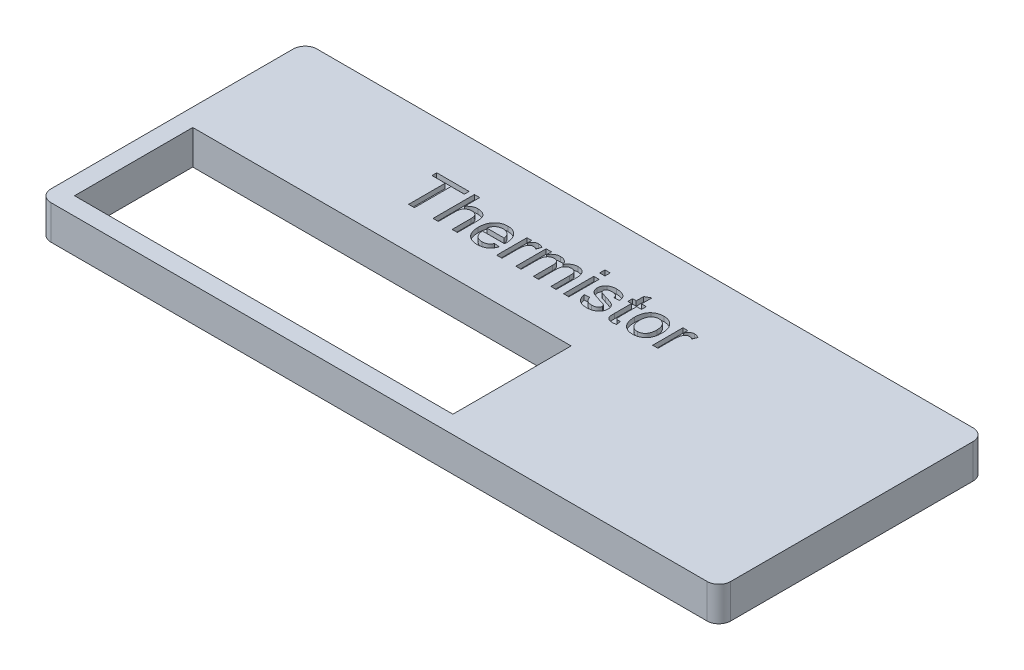
from build123d import *

# Parameters (mm, degrees)
BOSS_EXTRUDE1_DEPTH = 2.9
CUT_EXTRUDE1_DEPTH  = 10
SKETCH3_W           = 0.448717949
SKETCH3_H           = 0.448717949
SKETCH3_H_2         = 2.557692308
CUT_EXTRUDE2_DEPTH  = 0.5


with BuildPart() as part:
    # Sketch1 → Boss-Extrude1 (new body)
    with BuildSketch(Plane(origin=(0, 0, 0), x_dir=(1, 0, 0), z_dir=(0, 1, 0))):
        with BuildLine():
            Line((1, 0), (56.5, 0))
            ThreePointArc((56.5, 0), (57.207106781, 0.292893219), (57.5, 1))
            Line((57.5, 1), (57.5, 21.5))
            ThreePointArc((57.5, 21.5), (57.207106781, 22.207106781), (56.5, 22.5))
            Line((56.5, 22.5), (1, 22.5))
            ThreePointArc((1, 22.5), (0.292893219, 22.207106781), (0, 21.5))
            Line((0, 21.5), (0, 1))
            ThreePointArc((0, 1), (0.292893219, 0.292893219), (1, 0))
        make_face()
    extrude(amount=BOSS_EXTRUDE1_DEPTH)

    # Sketch2 → Cut-Extrude1 (cut)
    with BuildSketch(Plane(origin=(0, 0, 0), x_dir=(1, 0, 0), z_dir=(0, 1, 0))):
        Polygon((1.5, 11.5), (1.5, 1.5), (5.5, 1.5), (33.5, 1.5), (33.5, 11.5), align=None)
    extrude(amount=CUT_EXTRUDE1_DEPTH, mode=Mode.SUBTRACT)

    # Sketch3 → Cut-Extrude2 (cut)
    # profile 1 of 11: a face of its own
    with BuildSketch(Plane(origin=(0, 3, 0), x_dir=(1, 0, 0), z_dir=(0, 1, 0))):
        Polygon((16.256410256, 15), (16.256410256, 18.096153846), (15.134615385, 18.096153846), (15.134615385, 18.5), (17.871794872, 18.5), (17.871794872, 18.096153846), (16.75, 18.096153846), (16.75, 15), align=None)
    # profile 2 of 11: a face of its own
    with BuildSketch(Plane(origin=(0, 3, 0), x_dir=(1, 0, 0), z_dir=(0, 1, 0))):
        with BuildLine():
            Line((18.320512821, 15), (18.320512821, 18.5))
            Line((18.320512821, 18.5), (18.769230769, 18.5))
            Line((18.769230769, 18.5), (18.769230769, 17.221854968))
            add(Edge.make_bspline(
                [(18.769230769, 17.221854968), (18.794079358, 17.252104718), (18.842872975, 17.311504255), (18.925191786, 17.389105738), (19.01208256, 17.455536539), (19.104562491, 17.508587822), (19.201062428, 17.551701893), (19.303120274, 17.580546409), (19.409553396, 17.599897429), (19.482416778, 17.601665785), (19.51943109, 17.602564103)],
                knots=[0, 0, 0, 0, 1.075179344, 2.11126231, 3.101893549, 4.07484835, 5.035680757, 5.999322527, 6.983663715, 8, 8, 8, 8], degree=3))
            add(Edge.make_bspline(
                [(19.51943109, 17.602564103), (19.564400857, 17.601345725), (19.651592096, 17.598983429), (19.777649101, 17.577049907), (19.895224655, 17.543440682), (20.002317395, 17.494070877), (20.098174203, 17.433558586), (20.180266733, 17.36102193), (20.247692709, 17.277752437), (20.290621485, 17.198944304), (20.318715386, 17.130449723), (20.33570173, 17.072462625), (20.351164519, 17.009586014), (20.364023927, 16.941051585), (20.372473623, 16.86673756), (20.379680903, 16.787040969), (20.383870046, 16.701666968), (20.384361159, 16.642966499), (20.384615385, 16.612580128)],
                knots=[0, 0, 0, 0, 1.423572297, 2.760143949, 4.041704725, 5.287516156, 6.482931736, 7.621116371, 8.742804, 9.859691372, 10.450931907, 11.085684043, 11.77170108, 12.502189623, 13.292936877, 14.140280139, 15.037313705, 16, 16, 16, 16], degree=3))
            Line((20.384615385, 16.612580128), (20.384615385, 15))
            Line((20.384615385, 15), (19.935897436, 15))
            Line((19.935897436, 15), (19.935897436, 16.589443109))
            add(Edge.make_bspline(
                [(19.935897436, 16.589443109), (19.935523443, 16.615164741), (19.934801438, 16.664821106), (19.928459456, 16.736503635), (19.918067437, 16.802847253), (19.90347159, 16.863859103), (19.884875505, 16.919803781), (19.860762643, 16.969628019), (19.833321052, 17.014496609), (19.801590747, 17.05417471), (19.765625159, 17.088316771), (19.726723129, 17.118559604), (19.683628794, 17.142667261), (19.637515384, 17.16341918), (19.587699731, 17.179552), (19.53428213, 17.190331897), (19.477575948, 17.197846455), (19.438594975, 17.19842121), (19.418469551, 17.198717949)],
                knots=[0, 0, 0, 0, 1.348466509, 2.603254179, 3.769725567, 4.866462031, 5.889525116, 6.854190675, 7.762162134, 8.642507241, 9.509185433, 10.357210019, 11.219023099, 12.091228191, 13.005791182, 13.957527608, 14.945495211, 16, 16, 16, 16], degree=3))
            add(Edge.make_bspline(
                [(19.418469551, 17.198717949), (19.387993367, 17.197488932), (19.327657438, 17.195055757), (19.238439266, 17.175903636), (19.152145015, 17.145032261), (19.069859065, 17.102354661), (18.99424561, 17.049968727), (18.929634005, 16.986847028), (18.877138335, 16.914913375), (18.835218652, 16.833481498), (18.805573527, 16.73928831), (18.784280658, 16.630919877), (18.771118161, 16.506796524), (18.769882909, 16.418637908), (18.769230769, 16.372095353)],
                knots=[0, 0, 0, 0, 0.917620555, 1.816680451, 2.736567805, 3.671956967, 4.601896568, 5.4982222, 6.379906244, 7.274321234, 8.245216896, 9.344499276, 10.598052048, 12, 12, 12, 12], degree=3))
            Line((18.769230769, 16.372095353), (18.769230769, 15))
            Line((18.769230769, 15), (18.320512821, 15))
        make_face()
    # profile 3 of 11: a face of its own
    with BuildSketch(Plane(origin=(0, 3, 0), x_dir=(1, 0, 0), z_dir=(0, 1, 0))):
        with BuildLine():
            Line((22.75791266, 15.762820513), (23.197516026, 15.717948718))
            add(Edge.make_bspline(
                [(23.197516026, 15.717948718), (23.188502414, 15.688296348), (23.170770878, 15.629964337), (23.134793497, 15.547231904), (23.095259214, 15.468632168), (23.048550263, 15.395877903), (22.997299194, 15.32742068), (22.940490543, 15.26380654), (22.876882544, 15.206640566), (22.808839523, 15.153535451), (22.735229324, 15.106865004), (22.656827899, 15.065660563), (22.57334817, 15.031654596), (22.48502839, 15.003325724), (22.391666677, 14.981719425), (22.293436242, 14.966792807), (22.190466688, 14.956217868), (22.120153995, 14.955497322), (22.084134615, 14.955128205)],
                knots=[0, 0, 0, 0, 1.017198368, 2.001028156, 2.958938375, 3.904526299, 4.836491671, 5.766019286, 6.700699831, 7.641977538, 8.598163567, 9.559604839, 10.547559217, 11.555094156, 12.60347703, 13.691418688, 14.817373327, 16, 16, 16, 16], degree=3))
            add(Edge.make_bspline(
                [(22.084134615, 14.955128205), (22.038976972, 14.956189389), (21.950933573, 14.958258369), (21.822356911, 14.974856256), (21.700905667, 15.001112267), (21.586315347, 15.038312422), (21.47932029, 15.086791035), (21.37964879, 15.14641453), (21.286680882, 15.215805403), (21.201754831, 15.29618568), (21.124917135, 15.385770716), (21.059294601, 15.485381426), (21.002381299, 15.592630574), (20.957116063, 15.709260301), (20.921338143, 15.83410287), (20.896513928, 15.967689578), (20.8806314, 16.109490425), (20.879027872, 16.207053398), (20.878205128, 16.257111378)],
                knots=[0, 0, 0, 0, 1.077616366, 2.10101772, 3.089143248, 4.040031729, 4.971276009, 5.886882173, 6.807369977, 7.734796568, 8.672701003, 9.618074947, 10.576315496, 11.565652878, 12.598619221, 13.67195277, 14.805516698, 16, 16, 16, 16], degree=3))
            add(Edge.make_bspline(
                [(20.878205128, 16.257111378), (20.879035846, 16.309034007), (20.880648846, 16.409851923), (20.896327739, 16.556642617), (20.92225739, 16.69446477), (20.957443177, 16.82381841), (21.004066674, 16.94407866), (21.060955793, 17.055201677), (21.127758773, 17.157789114), (21.205120908, 17.250338761), (21.290722634, 17.332637973), (21.381844178, 17.405820119), (21.480397928, 17.466214914), (21.584369381, 17.516358836), (21.69476062, 17.554884434), (21.810891623, 17.583256642), (21.933646637, 17.599266301), (22.017482973, 17.601449293), (22.060296474, 17.602564103)],
                knots=[0, 0, 0, 0, 1.232307979, 2.392766439, 3.499416159, 4.558769794, 5.570548426, 6.555643267, 7.517416609, 8.470735273, 9.412423306, 10.33263532, 11.239503873, 12.150233765, 13.067967044, 14.009932887, 14.983713455, 16, 16, 16, 16], degree=3))
            add(Edge.make_bspline(
                [(22.060296474, 17.602564103), (22.101720164, 17.601498886), (22.182787532, 17.599414226), (22.301553965, 17.582682538), (22.414724016, 17.556536454), (22.522060084, 17.518560696), (22.623021955, 17.468711187), (22.718700023, 17.409214649), (22.808425914, 17.338349148), (22.891624175, 17.257080281), (22.967430175, 17.166320509), (23.033003503, 17.065717847), (23.088527798, 16.956686925), (23.13353855, 16.838394186), (23.168186173, 16.711521452), (23.193287454, 16.575985658), (23.209117511, 16.431832885), (23.210716485, 16.332641473), (23.211538462, 16.281650641)],
                knots=[0, 0, 0, 0, 1.005323219, 1.967446859, 2.906060863, 3.821317632, 4.724696067, 5.63467896, 6.55185077, 7.494776645, 8.453732942, 9.416859909, 10.403972786, 11.418730779, 12.484189468, 13.592581733, 14.76243057, 16, 16, 16, 16], degree=3))
            add(Edge.make_bspline(
                [(23.211538462, 16.281650641), (23.211324934, 16.265758188), (23.210809922, 16.22742689), (23.209942739, 16.189101849), (23.209435096, 16.166666667)],
                knots=[0, 0, 0, 0, 0.829215456, 2, 2, 2, 2], degree=3))
            Line((23.209435096, 16.166666667), (21.326923077, 16.166666667))
            add(Edge.make_bspline(
                [(21.326923077, 16.166666667), (21.329520811, 16.135065356), (21.334603018, 16.073240559), (21.349423476, 15.983729659), (21.369424041, 15.899607765), (21.396347161, 15.821615578), (21.428152329, 15.74887961), (21.467458164, 15.682596256), (21.511248206, 15.621293352), (21.561561875, 15.566465499), (21.615860082, 15.517696575), (21.673965676, 15.474915241), (21.735775615, 15.439431508), (21.800395715, 15.409601109), (21.868429839, 15.387153696), (21.939567502, 15.371089663), (22.01420573, 15.361039504), (22.065172494, 15.359671508), (22.091145833, 15.358974359)],
                knots=[0, 0, 0, 0, 1.224729154, 2.396059788, 3.502114335, 4.561587772, 5.580251543, 6.563724943, 7.533714888, 8.486186356, 9.43260269, 10.350144711, 11.268619442, 12.181885516, 13.095687177, 14.031096784, 14.996620783, 16, 16, 16, 16], degree=3))
            add(Edge.make_bspline(
                [(22.091145833, 15.358974359), (22.129068753, 15.36024408), (22.20253503, 15.362703851), (22.30854021, 15.379960912), (22.405710622, 15.410388575), (22.494729135, 15.452626154), (22.575448028, 15.508615494), (22.645882038, 15.580280814), (22.708503092, 15.665217081), (22.741073176, 15.729555873), (22.75791266, 15.762820513)],
                knots=[0, 0, 0, 0, 1.096312125, 2.123833578, 3.094060441, 4.030938787, 4.962563683, 5.918139224, 6.923629937, 8, 8, 8, 8], degree=3))
        make_face()
        with BuildLine():
            Line((21.326923077, 16.570512821), (22.762820513, 16.570512821))
            add(Edge.make_bspline(
                [(22.762820513, 16.570512821), (22.759995949, 16.592745256), (22.75447331, 16.636214531), (22.742849042, 16.699087406), (22.727345965, 16.757665577), (22.708674885, 16.811729025), (22.68590677, 16.861381249), (22.660182509, 16.906698434), (22.631438877, 16.94816454), (22.609099289, 16.972262917), (22.598056891, 16.984174679)],
                knots=[0, 0, 0, 0, 1.185316253, 2.317552585, 3.379013743, 4.387694847, 5.339152611, 6.263729899, 7.141766409, 8, 8, 8, 8], degree=3))
            add(Edge.make_bspline(
                [(22.598056891, 16.984174679), (22.580413657, 17.001395038), (22.545565253, 17.035408189), (22.487463531, 17.079253316), (22.42502134, 17.115613554), (22.35945263, 17.146985753), (22.289290807, 17.16971409), (22.21594061, 17.186884029), (22.138380988, 17.196610504), (22.085329094, 17.198004779), (22.058193109, 17.198717949)],
                knots=[0, 0, 0, 0, 0.989486767, 1.954405495, 2.91383024, 3.888017634, 4.867526279, 5.869356945, 6.910178459, 8, 8, 8, 8], degree=3))
            add(Edge.make_bspline(
                [(22.058193109, 17.198717949), (22.033633084, 17.198147613), (21.985558529, 17.197031219), (21.914734129, 17.189175169), (21.846853455, 17.176151853), (21.782036837, 17.156828994), (21.720047519, 17.133344349), (21.661321367, 17.103323722), (21.60544731, 17.068440798), (21.552647892, 17.028539475), (21.504883861, 16.983822693), (21.461203033, 16.936189371), (21.425039683, 16.883543626), (21.392975413, 16.828338405), (21.367868873, 16.768850828), (21.348103898, 16.70595722), (21.33403432, 16.639484249), (21.329314612, 16.593708148), (21.326923077, 16.570512821)],
                knots=[0, 0, 0, 0, 1.10270868, 2.158476208, 3.195774995, 4.201977093, 5.192014471, 6.168217026, 7.158254405, 8.146844603, 9.134487423, 10.093158795, 11.042305272, 11.996428104, 12.955501471, 13.934632866, 14.95345241, 16, 16, 16, 16], degree=3))
        make_face(mode=Mode.SUBTRACT)
    # profile 4 of 11: a face of its own
    with BuildSketch(Plane(origin=(0, 3, 0), x_dir=(1, 0, 0), z_dir=(0, 1, 0))):
        with BuildLine():
            Line((23.705128205, 15), (23.705128205, 17.557692308))
            Line((23.705128205, 17.557692308), (24.108974359, 17.557692308))
            Line((24.108974359, 17.557692308), (24.108974359, 17.200821314))
            add(Edge.make_bspline(
                [(24.108974359, 17.200821314), (24.131564075, 17.23856757), (24.173414557, 17.308497576), (24.239420526, 17.400647372), (24.302224472, 17.472819826), (24.365624054, 17.524245533), (24.429069698, 17.559836274), (24.493855096, 17.584338576), (24.561635891, 17.599903329), (24.607855181, 17.601668388), (24.631310096, 17.602564103)],
                knots=[0, 0, 0, 0, 1.517336028, 2.811068648, 3.907416798, 4.807929446, 5.613162482, 6.406966847, 7.191583018, 8, 8, 8, 8], degree=3))
            add(Edge.make_bspline(
                [(24.631310096, 17.602564103), (24.666024256, 17.601014866), (24.736385708, 17.597874748), (24.841810718, 17.573775693), (24.94848307, 17.537238187), (25.016425207, 17.50117436), (25.051282051, 17.482672276)],
                knots=[0, 0, 0, 0, 0.943117096, 1.911585642, 2.928565726, 4, 4, 4, 4], degree=3))
            Line((25.051282051, 17.482672276), (24.911057692, 17.093549679))
            add(Edge.make_bspline(
                [(24.911057692, 17.093549679), (24.886713199, 17.109735919), (24.839762366, 17.140952727), (24.764478904, 17.174014667), (24.689256051, 17.195116388), (24.6386861, 17.197529547), (24.613782051, 17.198717949)],
                knots=[0, 0, 0, 0, 1.093324321, 2.108587182, 3.068540977, 4, 4, 4, 4], degree=3))
            add(Edge.make_bspline(
                [(24.613782051, 17.198717949), (24.592179489, 17.197620504), (24.549526033, 17.195453639), (24.487204024, 17.17862316), (24.428569887, 17.150806896), (24.373668823, 17.112861014), (24.324840119, 17.064897149), (24.28198396, 17.008802769), (24.247352027, 16.943592566), (24.231448854, 16.895873774), (24.223257212, 16.871294071)],
                knots=[0, 0, 0, 0, 0.946345552, 1.868524143, 2.808299705, 3.780481321, 4.780563855, 5.797153696, 6.865325266, 8, 8, 8, 8], degree=3))
            add(Edge.make_bspline(
                [(24.223257212, 16.871294071), (24.212559237, 16.831475109), (24.19083924, 16.750631043), (24.169984504, 16.624834977), (24.155884194, 16.493713055), (24.154535063, 16.404386874), (24.153846154, 16.358774038)],
                knots=[0, 0, 0, 0, 0.953038166, 1.934944501, 2.945515915, 4, 4, 4, 4], degree=3))
            Line((24.153846154, 16.358774038), (24.153846154, 15))
            Line((24.153846154, 15), (23.705128205, 15))
        make_face()
    # profile 5 of 11: a face of its own
    with BuildSketch(Plane(origin=(0, 3, 0), x_dir=(1, 0, 0), z_dir=(0, 1, 0))):
        with BuildLine():
            Line((25.326121795, 15), (25.326121795, 17.557692308))
            Line((25.326121795, 17.557692308), (25.774839744, 17.557692308))
            Line((25.774839744, 17.557692308), (25.774839744, 17.158754006))
            add(Edge.make_bspline(
                [(25.774839744, 17.158754006), (25.794592954, 17.191107232), (25.833565974, 17.254940039), (25.90584811, 17.340226448), (25.986002631, 17.416492652), (26.075011156, 17.482769968), (26.172725718, 17.53639149), (26.27775384, 17.575226442), (26.389667593, 17.598198645), (26.466272227, 17.601087976), (26.505408654, 17.602564103)],
                knots=[0, 0, 0, 0, 1.012837134, 1.998324314, 2.98019487, 3.968118755, 4.958650973, 5.951725623, 6.953560186, 8, 8, 8, 8], degree=3))
            add(Edge.make_bspline(
                [(26.505408654, 17.602564103), (26.548066056, 17.601275753), (26.630136966, 17.598797028), (26.747036936, 17.574579624), (26.852086652, 17.535130708), (26.945008328, 17.480101527), (27.024772418, 17.410163951), (27.093389289, 17.328692445), (27.147909727, 17.233458316), (27.172769689, 17.163645469), (27.185496795, 17.127904647)],
                knots=[0, 0, 0, 0, 1.14260047, 2.198311542, 3.184080093, 4.139503782, 5.07683556, 6.015590709, 6.984077836, 8, 8, 8, 8], degree=3))
            add(Edge.make_bspline(
                [(27.185496795, 17.127904647), (27.210321802, 17.165723336), (27.258447018, 17.239037818), (27.343168601, 17.335143633), (27.431215558, 17.418467274), (27.526199843, 17.485733245), (27.626792015, 17.538461268), (27.733277985, 17.575731794), (27.845502387, 17.597973276), (27.922042063, 17.60101724), (27.9609375, 17.602564103)],
                knots=[0, 0, 0, 0, 1.138522562, 2.207114883, 3.219638414, 4.186902816, 5.129823568, 6.072192529, 7.02033929, 8, 8, 8, 8], degree=3))
            add(Edge.make_bspline(
                [(27.9609375, 17.602564103), (27.99111505, 17.601878174), (28.049998355, 17.600539769), (28.135577745, 17.590526229), (28.216009653, 17.574861616), (28.290822926, 17.551390364), (28.360474916, 17.522079105), (28.424975261, 17.486264728), (28.483354341, 17.443102267), (28.536573934, 17.393704035), (28.583684983, 17.337041854), (28.625408688, 17.273821823), (28.659698927, 17.202934401), (28.687459148, 17.125248008), (28.710268867, 17.040944339), (28.724896073, 16.949049307), (28.735301975, 16.850499696), (28.736012673, 16.782281834), (28.736378205, 16.747195513)],
                knots=[0, 0, 0, 0, 1.095882962, 2.138318376, 3.1255456, 4.06796008, 4.980856081, 5.866385201, 6.740777206, 7.611659656, 8.497473544, 9.411000816, 10.356316449, 11.349910013, 12.40416823, 13.523408539, 14.726220937, 16, 16, 16, 16], degree=3))
            Line((28.736378205, 16.747195513), (28.736378205, 15))
            Line((28.736378205, 15), (28.287660256, 15))
            Line((28.287660256, 15), (28.287660256, 16.581730769))
            add(Edge.make_bspline(
                [(28.287660256, 16.581730769), (28.2870125, 16.621227713), (28.285811635, 16.694450464), (28.280064058, 16.795592423), (28.266662181, 16.878776976), (28.249772248, 16.946834967), (28.224578638, 17.003087821), (28.192300743, 17.052068733), (28.150439442, 17.094654469), (28.101706273, 17.131374149), (28.046864273, 17.161801147), (27.986603455, 17.183722504), (27.92127422, 17.196446126), (27.876158409, 17.197946579), (27.852964744, 17.198717949)],
                knots=[0, 0, 0, 0, 1.637099343, 3.034992218, 4.192454477, 5.125064895, 5.931363659, 6.734457378, 7.542615046, 8.392902438, 9.255454751, 10.131653416, 11.039498489, 12, 12, 12, 12], degree=3))
            add(Edge.make_bspline(
                [(27.852964744, 17.198717949), (27.831896231, 17.198224335), (27.790520589, 17.197254945), (27.730055278, 17.188290645), (27.671999189, 17.175547605), (27.617270523, 17.155403293), (27.564819854, 17.13075431), (27.514957233, 17.100796725), (27.46839411, 17.064285907), (27.424197692, 17.023267888), (27.383618615, 16.976062928), (27.349143854, 16.921434289), (27.320857664, 16.860132839), (27.296634673, 16.792630068), (27.278094913, 16.718647187), (27.264784155, 16.637993274), (27.25727138, 16.550790881), (27.256176621, 16.490365682), (27.255608974, 16.459034455)],
                knots=[0, 0, 0, 0, 0.936978583, 1.840096209, 2.715540616, 3.577474171, 4.428863993, 5.292176944, 6.159677271, 7.057388756, 7.97228745, 8.921538631, 9.921836886, 10.971267826, 12.108934396, 13.31095831, 14.605698001, 16, 16, 16, 16], degree=3))
            Line((27.255608974, 16.459034455), (27.255608974, 15))
            Line((27.255608974, 15), (26.806891026, 15))
            Line((26.806891026, 15), (26.806891026, 16.631510417))
            add(Edge.make_bspline(
                [(26.806891026, 16.631510417), (26.80672158, 16.654426454), (26.806394361, 16.698680089), (26.801056791, 16.762995754), (26.793915274, 16.823043523), (26.782499381, 16.878493195), (26.768757374, 16.929534301), (26.751029605, 16.975856307), (26.730890416, 17.018385908), (26.706884108, 17.056500319), (26.679622658, 17.090461486), (26.648176833, 17.119659031), (26.612945116, 17.144503555), (26.573064884, 17.164068683), (26.529487272, 17.179406113), (26.482016126, 17.190547631), (26.430612786, 17.197819443), (26.394891461, 17.198411502), (26.376402244, 17.198717949)],
                knots=[0, 0, 0, 0, 1.345752242, 2.598810075, 3.789149697, 4.895786345, 5.921724826, 6.890687139, 7.805619527, 8.681717145, 9.530827886, 10.356528998, 11.194466742, 12.054057324, 12.95727461, 13.903003647, 14.914602983, 16, 16, 16, 16], degree=3))
            add(Edge.make_bspline(
                [(26.376402244, 17.198717949), (26.347781476, 17.197796748), (26.291103622, 17.19597249), (26.208331205, 17.17657577), (26.128743715, 17.146963408), (26.053391272, 17.105807035), (25.984080989, 17.05355086), (25.925119637, 16.988376225), (25.876634951, 16.912376638), (25.844591428, 16.84122591), (25.824292344, 16.778068392), (25.811209126, 16.724851735), (25.800076955, 16.666799753), (25.791158093, 16.603593457), (25.783133728, 16.535611296), (25.778894565, 16.462339862), (25.774771446, 16.384293364), (25.774816463, 16.330502224), (25.774839744, 16.302684295)],
                knots=[0, 0, 0, 0, 1.117976261, 2.213934112, 3.307715435, 4.433034498, 5.561469973, 6.68771744, 7.851930709, 9.075635627, 9.729167061, 10.44550689, 11.218440431, 12.040901402, 12.942650761, 13.89578902, 14.911813504, 16, 16, 16, 16], degree=3))
            Line((25.774839744, 16.302684295), (25.774839744, 15))
            Line((25.774839744, 15), (25.326121795, 15))
        make_face()
    # profile 6 of 11: a face of its own
    with BuildSketch(Plane(origin=(0, 3, 0), x_dir=(1, 0, 0), z_dir=(0, 1, 0))):
        with Locations((29.583333334, 18.275641026)):
            Rectangle(SKETCH3_W, SKETCH3_H)
    # profile 7 of 11: a face of its own
    with BuildSketch(Plane(origin=(0, 3, 0), x_dir=(1, 0, 0), z_dir=(0, 1, 0))):
        with Locations((29.583333334, 16.278846154)):
            Rectangle(SKETCH3_W, SKETCH3_H_2)
    # profile 8 of 11: a face of its own
    with BuildSketch(Plane(origin=(0, 3, 0), x_dir=(1, 0, 0), z_dir=(0, 1, 0))):
        with BuildLine():
            Line((30.301282051, 15.807692308), (30.75, 15.852564103))
            add(Edge.make_bspline(
                [(30.75, 15.852564103), (30.756853793, 15.814590177), (30.769980006, 15.741863469), (30.810294538, 15.641635466), (30.864686911, 15.554951113), (30.923274735, 15.494566819), (30.97776208, 15.455663093), (31.022076258, 15.429246416), (31.070790277, 15.407913494), (31.122713725, 15.389457753), (31.178588784, 15.375472937), (31.238390644, 15.36575554), (31.302148855, 15.360306353), (31.345943426, 15.359425713), (31.368389423, 15.358974359)],
                knots=[0, 0, 0, 0, 1.576426584, 3.019132651, 4.39139761, 5.744583744, 6.429748217, 7.128801231, 7.852561526, 8.603024018, 9.382742032, 10.206978913, 11.081024327, 12, 12, 12, 12], degree=3))
            add(Edge.make_bspline(
                [(31.368389423, 15.358974359), (31.390841304, 15.359090719), (31.43442023, 15.359316574), (31.497346317, 15.365397146), (31.555951638, 15.373480416), (31.609967669, 15.385165299), (31.65928182, 15.40089548), (31.70477496, 15.418721833), (31.745270007, 15.441263872), (31.792216361, 15.474334229), (31.840620282, 15.521170879), (31.884814873, 15.583297227), (31.911963869, 15.651591474), (31.915093641, 15.699019313), (31.916666667, 15.722856571)],
                knots=[0, 0, 0, 0, 1.101207713, 2.137435615, 3.099211963, 4.003546554, 4.845050796, 5.637285753, 6.396976949, 7.112904354, 8.451176697, 9.67915534, 10.8335422, 12, 12, 12, 12], degree=3))
            add(Edge.make_bspline(
                [(31.916666667, 15.722856571), (31.916413379, 15.733665971), (31.915916215, 15.754883085), (31.907517752, 15.785284481), (31.895585532, 15.814018646), (31.878367943, 15.840905058), (31.856555182, 15.866049718), (31.829970116, 15.889655423), (31.798560395, 15.911162133), (31.775178426, 15.923384674), (31.763120994, 15.9296875)],
                knots=[0, 0, 0, 0, 0.948511305, 1.861774925, 2.756066261, 3.680846901, 4.658374041, 5.678500434, 6.80286706, 8, 8, 8, 8], degree=3))
            add(Edge.make_bspline(
                [(31.763120994, 15.9296875), (31.753119328, 15.934243588), (31.731264423, 15.944199215), (31.69449764, 15.957737109), (31.651835219, 15.973723947), (31.602080916, 15.98831714), (31.546339554, 16.005491994), (31.484128901, 16.023983055), (31.414870111, 16.041535607), (31.366742391, 16.054213098), (31.341746795, 16.060797276)],
                knots=[0, 0, 0, 0, 0.596822396, 1.30413245, 2.127382897, 3.071041962, 4.119245502, 5.296370109, 6.595843667, 8, 8, 8, 8], degree=3))
            add(Edge.make_bspline(
                [(31.341746795, 16.060797276), (31.307607648, 16.070786271), (31.241821796, 16.090034982), (31.147166602, 16.118786236), (31.059715023, 16.146234048), (30.979409998, 16.172501358), (30.906623342, 16.198615852), (30.840992283, 16.222940788), (30.782962844, 16.246996745), (30.71565512, 16.275715787), (30.641588656, 16.316123756), (30.563236974, 16.373140078), (30.49693065, 16.439685161), (30.441925142, 16.513616454), (30.398748185, 16.593927662), (30.368859997, 16.679407762), (30.349752683, 16.768792192), (30.347364598, 16.829830835), (30.346153846, 16.860777244)],
                knots=[0, 0, 0, 0, 1.22605552, 2.362598816, 3.409724438, 4.385374865, 5.274589806, 6.075051486, 6.797583358, 7.439654886, 8.596878446, 9.697305961, 10.768176168, 11.821850251, 12.863383541, 13.897821176, 14.934201653, 16, 16, 16, 16], degree=3))
            add(Edge.make_bspline(
                [(30.346153846, 16.860777244), (30.347124242, 16.888882567), (30.349044912, 16.944510438), (30.363529539, 17.026158023), (30.386595444, 17.104927941), (30.419900385, 17.179759045), (30.460699601, 17.250371308), (30.509989174, 17.31435767), (30.564203567, 17.373592521), (30.606243412, 17.406561026), (30.627303686, 17.423076923)],
                knots=[0, 0, 0, 0, 1.034021226, 2.046601578, 3.042752055, 4.048071569, 5.054273975, 6.036661087, 7.016446045, 8, 8, 8, 8], degree=3))
            add(Edge.make_bspline(
                [(30.627303686, 17.423076923), (30.644856515, 17.435322972), (30.681633298, 17.460980958), (30.743788674, 17.494555173), (30.815118508, 17.524406287), (30.894100093, 17.551150743), (30.978855913, 17.574684656), (31.067867593, 17.590215459), (31.159681668, 17.600522884), (31.221825943, 17.60187633), (31.253405449, 17.602564103)],
                knots=[0, 0, 0, 0, 0.776203524, 1.626305774, 2.557252601, 3.57906176, 4.650888526, 5.745456612, 6.854321437, 8, 8, 8, 8], degree=3))
            add(Edge.make_bspline(
                [(31.253405449, 17.602564103), (31.300425554, 17.601484033), (31.39171751, 17.599387021), (31.524176853, 17.58329884), (31.647654554, 17.555910991), (31.76149538, 17.518577246), (31.863876233, 17.471898318), (31.953550412, 17.417554432), (32.028015895, 17.353762639), (32.089438831, 17.281892621), (32.138688318, 17.199439786), (32.178104782, 17.105588312), (32.209796094, 16.999502492), (32.22357099, 16.924046068), (32.230769231, 16.884615385)],
                knots=[0, 0, 0, 0, 1.253394935, 2.433530808, 3.550681177, 4.620594829, 5.621516506, 6.544862206, 7.406547904, 8.22431151, 9.054607538, 9.956211395, 10.931993099, 12, 12, 12, 12], degree=3))
            Line((32.230769231, 16.884615385), (31.782051282, 16.83974359))
            add(Edge.make_bspline(
                [(31.782051282, 16.83974359), (31.77671296, 16.86665571), (31.766354632, 16.918875225), (31.734993611, 16.991161225), (31.690460971, 17.053389357), (31.633906256, 17.106210839), (31.565104484, 17.148908896), (31.482866216, 17.177841566), (31.388852342, 17.196392842), (31.321747238, 17.197915139), (31.286358173, 17.198717949)],
                knots=[0, 0, 0, 0, 0.971549383, 1.88516682, 2.771115596, 3.668786025, 4.614654303, 5.622170142, 6.746009326, 8, 8, 8, 8], degree=3))
            add(Edge.make_bspline(
                [(31.286358173, 17.198717949), (31.265084748, 17.19846492), (31.224129039, 17.197977788), (31.164891837, 17.193818491), (31.110434153, 17.186631607), (31.060278529, 17.17820423), (31.015479684, 17.165162976), (30.974738452, 17.150843045), (30.939189861, 17.132507018), (30.898873023, 17.106242193), (30.858757381, 17.068213196), (30.821267805, 17.018827641), (30.798907761, 16.963723799), (30.796216612, 16.925467535), (30.794871795, 16.90635016)],
                knots=[0, 0, 0, 0, 1.202032812, 2.314159929, 3.352655878, 4.305866621, 5.183839704, 5.986040797, 6.742017283, 7.437935182, 8.699432998, 9.843179159, 10.922196019, 12, 12, 12, 12], degree=3))
            add(Edge.make_bspline(
                [(30.794871795, 16.90635016), (30.79532304, 16.894130541), (30.796212912, 16.870033017), (30.805956048, 16.835250911), (30.820748445, 16.802256745), (30.834718049, 16.782511966), (30.841846955, 16.772435897)],
                knots=[0, 0, 0, 0, 1.012137305, 1.99597066, 2.977312565, 4, 4, 4, 4], degree=3))
            add(Edge.make_bspline(
                [(30.841846955, 16.772435897), (30.850394273, 16.76227856), (30.868180325, 16.741142231), (30.903012745, 16.714846113), (30.943544155, 16.690135113), (30.973935268, 16.67694862), (30.989783654, 16.670072115)],
                knots=[0, 0, 0, 0, 0.873299099, 1.81724178, 2.861733162, 4, 4, 4, 4], degree=3))
            add(Edge.make_bspline(
                [(30.989783654, 16.670072115), (30.995847379, 16.667930482), (31.009996737, 16.662933102), (31.035104956, 16.655286235), (31.066827002, 16.645499395), (31.105934954, 16.634309107), (31.151677668, 16.620998624), (31.204801509, 16.606295055), (31.264568576, 16.589478784), (31.30691512, 16.577957942), (31.329126603, 16.571915064)],
                knots=[0, 0, 0, 0, 0.436802817, 1.019254657, 1.782618184, 2.69198815, 3.782349451, 5.018834001, 6.436327698, 8, 8, 8, 8], degree=3))
            add(Edge.make_bspline(
                [(31.329126603, 16.571915064), (31.362098453, 16.561927617), (31.425773032, 16.54264006), (31.517998233, 16.513602539), (31.60386068, 16.486544292), (31.683112568, 16.460660556), (31.7557006, 16.435834029), (31.821974102, 16.413070795), (31.881739011, 16.391128553), (31.951840471, 16.364860398), (32.031482654, 16.329464547), (32.115982735, 16.275793356), (32.190051788, 16.213476183), (32.25290413, 16.142462278), (32.303973334, 16.062158243), (32.339346389, 15.971946482), (32.361976752, 15.87307076), (32.364223471, 15.804083376), (32.365384615, 15.768429487)],
                knots=[0, 0, 0, 0, 1.155996739, 2.232437775, 3.244329082, 4.176768736, 5.029854173, 5.818511279, 6.528027969, 7.165934889, 8.330913826, 9.444808892, 10.513164249, 11.568838208, 12.615385132, 13.688622127, 14.805439433, 16, 16, 16, 16], degree=3))
            add(Edge.make_bspline(
                [(32.365384615, 15.768429487), (32.363930164, 15.73254155), (32.361028697, 15.660949169), (32.336643336, 15.555721002), (32.29860618, 15.453320989), (32.244613713, 15.355874983), (32.176672985, 15.264783702), (32.09371133, 15.184346272), (31.9969405, 15.114977844), (31.887674349, 15.05767444), (31.768410476, 15.010802312), (31.639999485, 14.979767039), (31.504443328, 14.958003239), (31.41125021, 14.956102487), (31.363481571, 14.955128205)],
                knots=[0, 0, 0, 0, 0.894809563, 1.785044015, 2.682170314, 3.614214614, 4.555721535, 5.508634546, 6.486485836, 7.51727745, 8.581064401, 9.676123613, 10.808834633, 12, 12, 12, 12], degree=3))
            add(Edge.make_bspline(
                [(31.363481571, 14.955128205), (31.324198415, 14.955820532), (31.248074862, 14.957162134), (31.137472699, 14.966935317), (31.03406096, 14.98353259), (30.937912796, 15.007275091), (30.848975351, 15.03747188), (30.766995737, 15.073816686), (30.692152421, 15.117465056), (30.624485857, 15.168161656), (30.563555268, 15.225941328), (30.508110658, 15.289619704), (30.458777136, 15.36013902), (30.416180763, 15.437325474), (30.377988533, 15.520362919), (30.345911287, 15.610203791), (30.319904969, 15.706620958), (30.307587742, 15.773469704), (30.301282051, 15.807692308)],
                knots=[0, 0, 0, 0, 1.244406412, 2.411431524, 3.514215425, 4.559320282, 5.545040859, 6.48623969, 7.395443761, 8.283912081, 9.158607275, 10.050831307, 10.954592804, 11.879399228, 12.840196462, 13.8472361, 14.897912238, 16, 16, 16, 16], degree=3))
        make_face()
    # profile 9 of 11: a face of its own
    with BuildSketch(Plane(origin=(0, 3, 0), x_dir=(1, 0, 0), z_dir=(0, 1, 0))):
        with BuildLine():
            Line((33.801282051, 15.370192308), (33.846153846, 14.993689904))
            add(Edge.make_bspline(
                [(33.846153846, 14.993689904), (33.817462562, 14.987762539), (33.761929987, 14.976290002), (33.680423094, 14.964830268), (33.603755152, 14.956075266), (33.554042914, 14.955437381), (33.529947917, 14.955128205)],
                knots=[0, 0, 0, 0, 1.101333134, 2.13165308, 3.094431941, 4, 4, 4, 4], degree=3))
            add(Edge.make_bspline(
                [(33.529947917, 14.955128205), (33.49415382, 14.95610473), (33.426498761, 14.957950477), (33.330994867, 14.970606616), (33.248153041, 14.993576771), (33.177285085, 15.02516847), (33.118441261, 15.065116666), (33.068932826, 15.110709028), (33.028853583, 15.162037971), (33.002295735, 15.210350036), (32.986661809, 15.255381784), (32.976330173, 15.297373729), (32.968435426, 15.34786899), (32.960550594, 15.406017551), (32.955028296, 15.472706863), (32.952148311, 15.547329068), (32.94878335, 15.630280893), (32.948740437, 15.68826357), (32.948717949, 15.71864984)],
                knots=[0, 0, 0, 0, 1.515965932, 2.865354161, 4.068592833, 5.144966063, 6.135994557, 7.067504024, 7.984224584, 8.88319335, 9.387210378, 9.999362939, 10.71208193, 11.550605788, 12.484373718, 13.544606854, 14.713232298, 16, 16, 16, 16], degree=3))
            Line((32.948717949, 15.71864984), (32.948717949, 17.153846154))
            Line((32.948717949, 17.153846154), (32.634615385, 17.153846154))
            Line((32.634615385, 17.153846154), (32.634615385, 17.557692308))
            Line((32.634615385, 17.557692308), (32.948717949, 17.557692308))
            Line((32.948717949, 17.557692308), (32.948717949, 18.180288462))
            Line((32.948717949, 18.180288462), (33.397435897, 18.435496795))
            Line((33.397435897, 18.435496795), (33.397435897, 17.557692308))
            Line((33.397435897, 17.557692308), (33.801282051, 17.557692308))
            Line((33.801282051, 17.557692308), (33.801282051, 17.153846154))
            Line((33.801282051, 17.153846154), (33.397435897, 17.153846154))
            Line((33.397435897, 17.153846154), (33.397435897, 15.702524038))
            add(Edge.make_bspline(
                [(33.397435897, 15.702524038), (33.397607933, 15.675171006), (33.397918447, 15.625800527), (33.402199238, 15.55982228), (33.407487133, 15.509719192), (33.418617741, 15.464353869), (33.444637641, 15.423210189), (33.479352064, 15.391989037), (33.514606585, 15.374313526), (33.547294034, 15.365802144), (33.584672465, 15.360130931), (33.611253159, 15.359374249), (33.625300481, 15.358974359)],
                knots=[0, 0, 0, 0, 1.693748017, 3.05710712, 4.093010578, 4.8128101, 5.929870973, 7.047775512, 7.662723095, 8.354621928, 9.130453249, 10, 10, 10, 10], degree=3))
            add(Edge.make_bspline(
                [(33.625300481, 15.358974359), (33.637221999, 15.359129778), (33.662950241, 15.359465193), (33.704325543, 15.36176682), (33.75108018, 15.365222664), (33.783994239, 15.368480932), (33.801282051, 15.370192308)],
                knots=[0, 0, 0, 0, 0.810958033, 1.750156657, 2.818290096, 4, 4, 4, 4], degree=3))
        make_face()
    # profile 10 of 11: a face of its own
    with BuildSketch(Plane(origin=(0, 3, 0), x_dir=(1, 0, 0), z_dir=(0, 1, 0))):
        with BuildLine():
            add(Edge.make_bspline(
                [(34.070512821, 16.278846154), (34.071769316, 16.335681053), (34.074200725, 16.445660732), (34.091611781, 16.605249716), (34.121461768, 16.753411182), (34.163352129, 16.890284286), (34.21752467, 17.015912153), (34.284447996, 17.129589933), (34.362276377, 17.233406085), (34.42438786, 17.292087598), (34.455428686, 17.321414263)],
                knots=[0, 0, 0, 0, 1.189940866, 2.302622481, 3.356378305, 4.350088409, 5.294652018, 6.213657312, 7.107257627, 8, 8, 8, 8], degree=3))
            add(Edge.make_bspline(
                [(34.455428686, 17.321414263), (34.482577983, 17.343952074), (34.536381198, 17.388616461), (34.624198043, 17.445257871), (34.715625152, 17.493922561), (34.811470406, 17.53427302), (34.912036717, 17.565102231), (35.017010929, 17.586499079), (35.126258867, 17.600478137), (35.200676964, 17.601860167), (35.238581731, 17.602564103)],
                knots=[0, 0, 0, 0, 0.994414631, 1.970684744, 2.940793954, 3.912782355, 4.898970837, 5.902128985, 6.931451948, 8, 8, 8, 8], degree=3))
            add(Edge.make_bspline(
                [(35.238581731, 17.602564103), (35.280453166, 17.601382766), (35.362382388, 17.599071262), (35.482609119, 17.583997733), (35.596455585, 17.555985765), (35.705387696, 17.519273224), (35.807755962, 17.470347594), (35.905177248, 17.412018211), (35.995266081, 17.341327699), (36.079749073, 17.261425459), (36.15596254, 17.172068443), (36.222362825, 17.073695704), (36.278594372, 16.967157028), (36.325044726, 16.852351412), (36.360667318, 16.729198601), (36.385497173, 16.597961777), (36.401403359, 16.45895882), (36.403018835, 16.363493264), (36.403846154, 16.314603365)],
                knots=[0, 0, 0, 0, 1.026363227, 2.008269884, 2.962742747, 3.895658536, 4.820662428, 5.738204837, 6.673158329, 7.621267452, 8.584296177, 9.545483285, 10.524327568, 11.531652541, 12.575780624, 13.660990097, 14.802144351, 16, 16, 16, 16], degree=3))
            add(Edge.make_bspline(
                [(36.403846154, 16.314603365), (36.403534435, 16.274861082), (36.402928806, 16.197647147), (36.395608149, 16.085139774), (36.384545523, 15.979158347), (36.369489037, 15.879582247), (36.349207224, 15.786571134), (36.323915528, 15.700199687), (36.294584702, 15.62000144), (36.260874239, 15.545890793), (36.22240921, 15.477269074), (36.180504459, 15.412657253), (36.134106588, 15.352153353), (36.083275071, 15.295857645), (36.028695846, 15.243361849), (35.969996517, 15.194466957), (35.90706873, 15.149876889), (35.818227241, 15.095738593), (35.700967532, 15.03900753), (35.55245224, 14.990390204), (35.397511376, 14.960758241), (35.291996688, 14.957020414), (35.238581731, 14.955128205)],
                knots=[0, 0, 0, 0, 1.174068422, 2.28105775, 3.329581501, 4.321819531, 5.255045276, 6.14001734, 6.978936381, 7.776151739, 8.542754425, 9.301196708, 10.049767304, 10.792968067, 11.540167917, 12.285482871, 13.048063169, 13.816653646, 15.357768987, 16.884132754, 18.422646949, 20, 20, 20, 20], degree=3))
            add(Edge.make_bspline(
                [(35.238581731, 14.955128205), (35.196002079, 14.956283024), (35.112661767, 14.958543327), (34.990734632, 14.973965066), (34.875018339, 15.000390337), (34.765861945, 15.038899274), (34.662292582, 15.086170818), (34.565288963, 15.145182016), (34.47466365, 15.214647063), (34.391216998, 15.295014105), (34.314918846, 15.384492414), (34.249788691, 15.48500325), (34.194045238, 15.594473521), (34.148502939, 15.713375345), (34.113714975, 15.841712301), (34.088732936, 15.979146531), (34.072941866, 16.125866975), (34.071337296, 16.226921436), (34.070512821, 16.278846154)],
                knots=[0, 0, 0, 0, 1.022681766, 2.001674804, 2.94671416, 3.868132449, 4.777362857, 5.676573364, 6.589418535, 7.514523194, 8.454681358, 9.407574523, 10.384198733, 11.400667853, 12.460217505, 13.573389442, 14.753137007, 16, 16, 16, 16], degree=3))
        make_face()
        with BuildLine():
            add(Edge.make_bspline(
                [(34.519230769, 16.280248397), (34.519992275, 16.24283954), (34.52146528, 16.170478403), (34.530256266, 16.065448833), (34.546315779, 15.967941557), (34.568658254, 15.877602327), (34.597315113, 15.794418331), (34.632437295, 15.718248735), (34.673641623, 15.649028969), (34.721822195, 15.587887475), (34.774259076, 15.53384518), (34.830816617, 15.487229419), (34.890708273, 15.44764683), (34.954035831, 15.41537233), (35.020512515, 15.389872576), (35.090282961, 15.371512288), (35.163470897, 15.360969765), (35.213307941, 15.359645786), (35.238581731, 15.358974359)],
                knots=[0, 0, 0, 0, 1.36128903, 2.633184439, 3.831299874, 4.953299848, 6.015607462, 7.027679361, 8.000438392, 8.93945591, 9.853536715, 10.73548639, 11.60109037, 12.460616037, 13.316600729, 14.187036799, 15.080594522, 16, 16, 16, 16], degree=3))
            add(Edge.make_bspline(
                [(35.238581731, 15.358974359), (35.263638337, 15.359546959), (35.313077524, 15.360676757), (35.385312714, 15.372638004), (35.454832786, 15.389797613), (35.521063356, 15.415117614), (35.583453368, 15.448516994), (35.643211826, 15.488024028), (35.699127445, 15.535321811), (35.752164242, 15.589260557), (35.799656375, 15.65130421), (35.842255506, 15.72024984), (35.877255791, 15.797656548), (35.90555117, 15.882338994), (35.928141078, 15.974477474), (35.944125805, 16.074107173), (35.952865456, 16.181467404), (35.954358978, 16.25546028), (35.955128205, 16.293569712)],
                knots=[0, 0, 0, 0, 0.904535546, 1.784739026, 2.638791991, 3.488785886, 4.338695884, 5.191202824, 6.07237792, 6.980061329, 7.919174549, 8.889507933, 9.902165842, 10.981000531, 12.111539881, 13.326270405, 14.622917219, 16, 16, 16, 16], degree=3))
            add(Edge.make_bspline(
                [(35.955128205, 16.293569712), (35.954352495, 16.329575153), (35.952843864, 16.399599873), (35.944151278, 16.501385645), (35.927885352, 16.596267749), (35.905977411, 16.684513624), (35.875947054, 16.765396614), (35.841441123, 16.840450098), (35.798841906, 16.908185507), (35.750513588, 16.968984903), (35.697765256, 17.02309241), (35.641708681, 17.070577301), (35.58175993, 17.109573488), (35.519363244, 17.142726737), (35.453508066, 17.167498439), (35.384816741, 17.186236575), (35.312760014, 17.196744129), (35.263621038, 17.198051675), (35.238581731, 17.198717949)],
                knots=[0, 0, 0, 0, 1.329905342, 2.586449315, 3.768451236, 4.882143757, 5.938857988, 6.950440627, 7.927559667, 8.885972819, 9.813736587, 10.714405609, 11.592966897, 12.450023853, 13.318821862, 14.185602452, 15.075453733, 16, 16, 16, 16], degree=3))
            add(Edge.make_bspline(
                [(35.238581731, 17.198717949), (35.213310088, 17.198040947), (35.163477277, 17.196705975), (35.090258538, 17.186243433), (35.020680799, 17.167611582), (34.95386537, 17.143223581), (34.890771632, 17.110638858), (34.830533124, 17.071273576), (34.774753235, 17.023774691), (34.721523112, 16.970568157), (34.673895299, 16.909419754), (34.632410525, 16.840895629), (34.597175395, 16.765202029), (34.568678757, 16.682185975), (34.546309841, 16.591856283), (34.530257618, 16.494346212), (34.521485985, 16.389550427), (34.519997797, 16.317423402), (34.519230769, 16.280248397)],
                knots=[0, 0, 0, 0, 0.920966903, 1.816042154, 2.687956485, 3.542385364, 4.403370762, 5.270444796, 6.159337503, 7.068888003, 8.009500254, 8.976623456, 9.982690403, 11.046802133, 12.170707598, 13.370857791, 14.644913259, 16, 16, 16, 16], degree=3))
        make_face(mode=Mode.SUBTRACT)
    # profile 11 of 11: a face of its own
    with BuildSketch(Plane(origin=(0, 3, 0), x_dir=(1, 0, 0), z_dir=(0, 1, 0))):
        with BuildLine():
            Line((36.897435897, 15), (36.897435897, 17.557692308))
            Line((36.897435897, 17.557692308), (37.301282051, 17.557692308))
            Line((37.301282051, 17.557692308), (37.301282051, 17.200821314))
            add(Edge.make_bspline(
                [(37.301282051, 17.200821314), (37.323871768, 17.23856757), (37.365722249, 17.308497576), (37.431728219, 17.400647372), (37.494532165, 17.472819826), (37.557931747, 17.524245533), (37.62137739, 17.559836274), (37.686162788, 17.584338576), (37.753943584, 17.599903329), (37.800162873, 17.601668388), (37.823617788, 17.602564103)],
                knots=[0, 0, 0, 0, 1.517336028, 2.811068648, 3.907416798, 4.807929446, 5.613162482, 6.406966847, 7.191583018, 8, 8, 8, 8], degree=3))
            add(Edge.make_bspline(
                [(37.823617788, 17.602564103), (37.858331948, 17.601014866), (37.928693401, 17.597874748), (38.03411841, 17.573775693), (38.140790763, 17.537238187), (38.208732899, 17.50117436), (38.243589744, 17.482672276)],
                knots=[0, 0, 0, 0, 0.943117096, 1.911585642, 2.928565726, 4, 4, 4, 4], degree=3))
            Line((38.243589744, 17.482672276), (38.103365385, 17.093549679))
            add(Edge.make_bspline(
                [(38.103365385, 17.093549679), (38.079020891, 17.109735919), (38.032070059, 17.140952727), (37.956786596, 17.174014667), (37.881563744, 17.195116388), (37.830993793, 17.197529547), (37.806089744, 17.198717949)],
                knots=[0, 0, 0, 0, 1.093324321, 2.108587182, 3.068540977, 4, 4, 4, 4], degree=3))
            add(Edge.make_bspline(
                [(37.806089744, 17.198717949), (37.784487181, 17.197620504), (37.741833725, 17.195453639), (37.679511716, 17.17862316), (37.620877579, 17.150806896), (37.565976516, 17.112861014), (37.517147812, 17.064897149), (37.474291652, 17.008802769), (37.439659719, 16.943592566), (37.423756546, 16.895873774), (37.415564904, 16.871294071)],
                knots=[0, 0, 0, 0, 0.946345552, 1.868524143, 2.808299705, 3.780481321, 4.780563855, 5.797153696, 6.865325266, 8, 8, 8, 8], degree=3))
            add(Edge.make_bspline(
                [(37.415564904, 16.871294071), (37.404866929, 16.831475109), (37.383146932, 16.750631043), (37.362292197, 16.624834977), (37.348191886, 16.493713055), (37.346842756, 16.404386874), (37.346153846, 16.358774038)],
                knots=[0, 0, 0, 0, 0.953038166, 1.934944501, 2.945515915, 4, 4, 4, 4], degree=3))
            Line((37.346153846, 16.358774038), (37.346153846, 15))
            Line((37.346153846, 15), (36.897435897, 15))
        make_face()
    extrude(amount=-CUT_EXTRUDE2_DEPTH, mode=Mode.SUBTRACT)


solid = part.part
